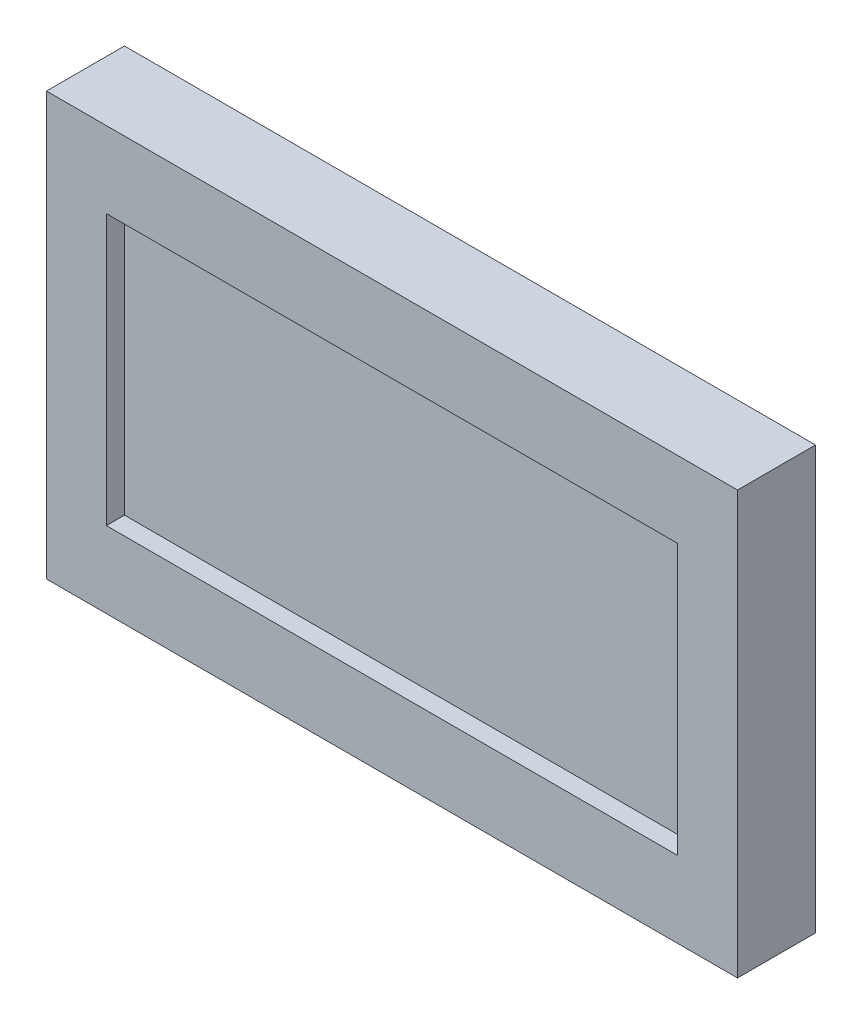
from build123d import *

# Parameters (mm, degrees)
SKICA1_W                 = 38.1
SKICA1_H                 = 23.3
P_IDAT_VYSUNUT_M1_DEPTH  = 4.3
SKICA2_W                 = 31.5
SKICA2_H                 = 14.9
ODEBRAT_VYSUNUT_M1_DEPTH = 4.3
SKICA3_W                 = 34.383278722
SKICA3_H                 = 19.702377316
ODEBRAT_VYSUNUT_M2_DEPTH = 3.3
SKICA6_W                 = 31.5
SKICA6_H                 = 14.9
P_IDAT_VYSUNUT_M3_DEPTH  = 3.3


with BuildPart() as part:
    # Skica1 → Přidat vysunutím1 (new body)
    with BuildSketch(Plane.XY):
        Rectangle(SKICA1_W, SKICA1_H)
    extrude(amount=P_IDAT_VYSUNUT_M1_DEPTH)

    # Skica2 → Odebrat vysunutím1 (cut)
    with BuildSketch(Plane.XY.offset(4.3)):
        Rectangle(SKICA2_W, SKICA2_H)
    extrude(amount=-ODEBRAT_VYSUNUT_M1_DEPTH, mode=Mode.SUBTRACT)

    # Skica3 → Odebrat vysunutím2 (cut)
    with BuildSketch(Plane(origin=(0, 0, 0), x_dir=(-1, 0, 0), z_dir=(0, 0, -1))):
        Rectangle(SKICA3_W, SKICA3_H)
    extrude(amount=-ODEBRAT_VYSUNUT_M2_DEPTH, mode=Mode.SUBTRACT)


with BuildPart() as body_2:
    # Skica6 → Přidat vysunutím3 (new body)
    with BuildSketch(Plane(origin=(0, 0, 3.3), x_dir=(-1, 0, 0), z_dir=(0, 0, -1))):
        Rectangle(SKICA6_W, SKICA6_H)
    extrude(amount=P_IDAT_VYSUNUT_M3_DEPTH)


solid = Compound([part.part, body_2.part])
